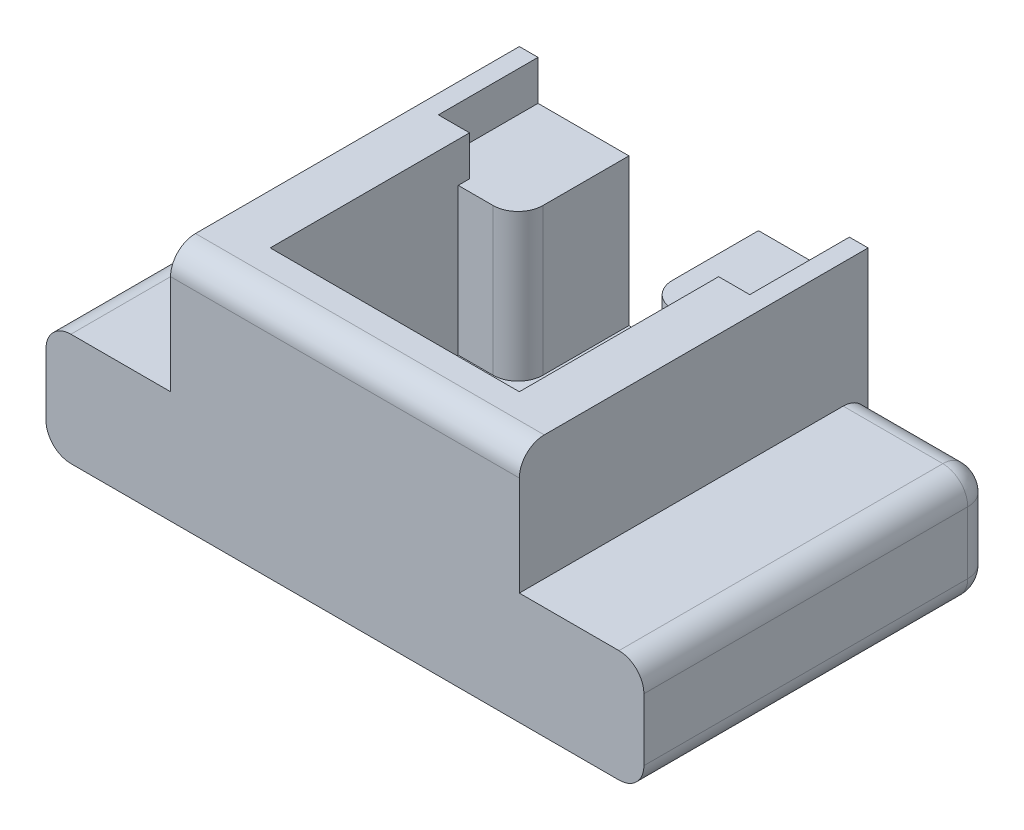
from build123d import *

# Parameters (mm, degrees)
SKETCH2_W           = 24
SKETCH2_H           = 14
BOSS_EXTRUDE1_DEPTH = 4.5
SKETCH3_W           = 14
SKETCH3_H           = 14
BOSS_EXTRUDE2_DEPTH = 5
CUT_EXTRUDE1_DEPTH  = 10
SKETCH5_W           = 10
SKETCH5_H           = 7.54749529
CUT_EXTRUDE2_DEPTH  = 7.5
SKETCH6_W           = 12.5
SKETCH6_H           = 1.6
CUT_EXTRUDE3_DEPTH  = 4
SKETCH7_W           = 10.060724294
SKETCH7_H           = 1.6
CUT_EXTRUDE4_DEPTH  = 1
SKETCH8_W           = 0.45250471
SKETCH8_H           = 1.6
CUT_EXTRUDE5_DEPTH  = 0.025884761
SKETCH9_W           = 1
SKETCH9_H           = 1.6
BOSS_EXTRUDE3_DEPTH = 0.086609054
FILLET1_R           = 1
FILLET2_R           = 1
FILLET3_R           = 1


with BuildPart() as part:
    # Sketch2 → Boss-Extrude1 (new body)
    with BuildSketch(Plane(origin=(0, 0, 0), x_dir=(1, 0, 0), z_dir=(0, 1, 0))):
        with Locations((2.394366197, 1.248826291)):
            Rectangle(SKETCH2_W, SKETCH2_H)
    extrude(amount=BOSS_EXTRUDE1_DEPTH)

    # Sketch3 → Boss-Extrude2 (add)
    with BuildSketch(Plane(origin=(0, 4.5, 0), x_dir=(1, 0, 0), z_dir=(0, 1, 0))):
        with Locations((2.394366197, 1.248826291)):
            Rectangle(SKETCH3_W, SKETCH3_H)
    extrude(amount=BOSS_EXTRUDE2_DEPTH)

    # Sketch4 → Cut-Extrude1 (cut)
    with BuildSketch(Plane(origin=(0, 0, -8.248826291), x_dir=(-1, 0, 0), z_dir=(0, 0, -1))):
        Polygon((-4.994366197, 4.2), (-4.994366197, 2), (0.205633803, 2), (0.205633803, 4.2), (0.205633803, 10.153994243), (-4.994366197, 10.153994243), align=None)
    extrude(amount=-CUT_EXTRUDE1_DEPTH, mode=Mode.SUBTRACT)

    # Sketch5 → Cut-Extrude2 (cut)
    with BuildSketch(Plane(origin=(0, 9.5, 0), x_dir=(1, 0, 0), z_dir=(0, 1, 0))):
        with Locations((2.394366197, 0.022573936)):
            Rectangle(SKETCH5_W, SKETCH5_H)
    extrude(amount=-CUT_EXTRUDE2_DEPTH, mode=Mode.SUBTRACT)

    # Sketch6 → Cut-Extrude3 (cut)
    with BuildSketch(Plane(origin=(0, 0, -8.248826291), x_dir=(-1, 0, 0), z_dir=(0, 0, -1))):
        with Locations((-2.394366197, 8.7)):
            Rectangle(SKETCH6_W, SKETCH6_H)
    extrude(amount=-CUT_EXTRUDE3_DEPTH, mode=Mode.SUBTRACT)

    # Sketch7 → Cut-Extrude4 (cut)
    with BuildSketch(Plane(origin=(0, 0, -4.248826291), x_dir=(-1, 0, 0), z_dir=(0, 0, -1))):
        with Locations((-2.33811929, 8.7)):
            Rectangle(SKETCH7_W, SKETCH7_H)
    extrude(amount=-CUT_EXTRUDE4_DEPTH, mode=Mode.SUBTRACT)

    # Sketch8 → Cut-Extrude5 (cut)
    with BuildSketch(Plane.ZY.offset(-7.368481437)):
        with Locations((-4.022573936, 8.7)):
            Rectangle(SKETCH8_W, SKETCH8_H)
    extrude(amount=-CUT_EXTRUDE5_DEPTH, mode=Mode.SUBTRACT)

    # Sketch9 → Boss-Extrude3 (add)
    with BuildSketch(Plane(origin=(-2.692242857, 0, 0), x_dir=(0, 0, -1), z_dir=(1, 0, 0))):
        with Locations((3.748826291, 8.7)):
            Rectangle(SKETCH9_W, SKETCH9_H)
    extrude(amount=BOSS_EXTRUDE3_DEPTH)

    # Fillet1
    fillet1_edges = [part.edges().sort_by_distance(p)[0] for p in [
        (14.394366197, 4.5, -1.248826291),
        (2.394366197, 9.5, 5.751173709),
        (-9.605633803, 4.5, -1.248826291),
        (14.394366197, 0, -1.248826291),
        (-9.605633803, 0, -1.248826291),
    ]]
    fillet(fillet1_edges, radius=FILLET1_R)

    # Fillet2
    fillet2_edges = [part.edges().sort_by_distance(p)[0] for p in [
        (-6.605633803, 4.5, -8.248826291),
        (-9.605633803, 2.25, -8.248826291),
        (2.394366197, 0, -8.248826291),
        (11.394366197, 4.5, -8.248826291),
        (14.394366197, 2.25, -8.248826291),
        (14.101472978, 4.207106781, -8.248826291),
        (14.101472978, 0.292893219, -8.248826291),
        (-9.312740584, 4.207106781, -8.248826291),
        (-9.312740584, 0.292893219, -8.248826291),
    ]]
    fillet(fillet2_edges, radius=FILLET2_R)

    # Fillet3
    fillet3_edges = [part.edges().sort_by_distance(p)[0] for p in [
        (-0.205633803, 4.95, -3.796321581),
        (4.994366197, 4.95, -3.796321581),
    ]]
    fillet(fillet3_edges, radius=FILLET3_R)


solid = part.part
